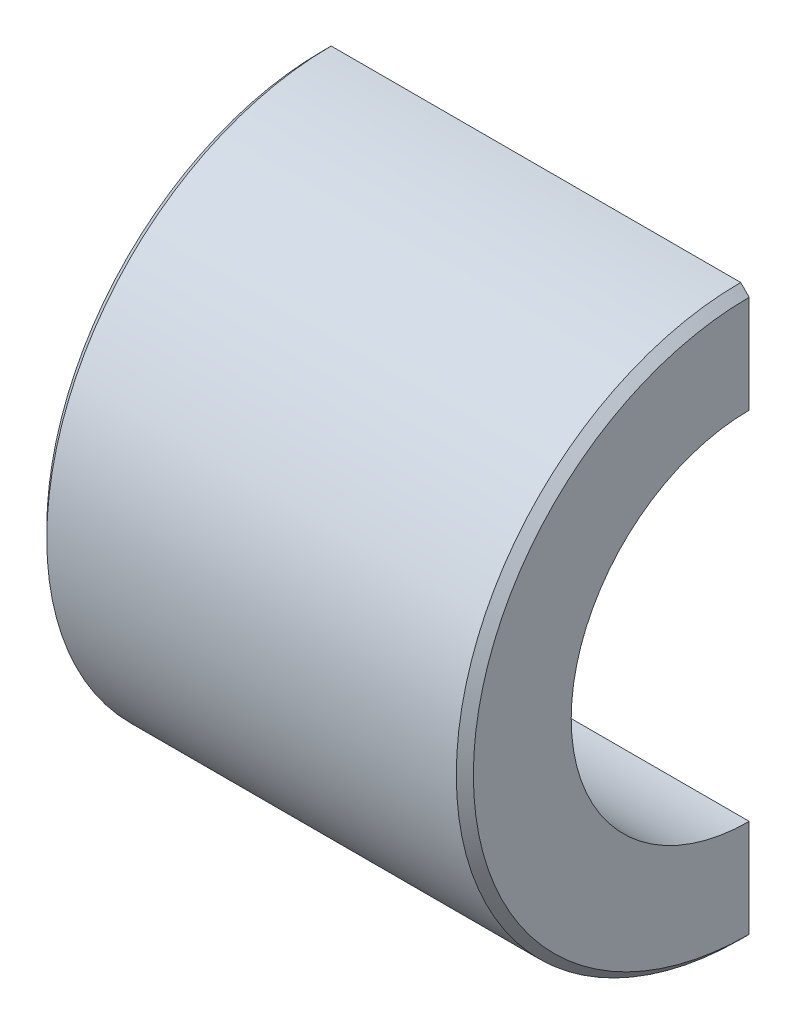
from build123d import *

# Parameters (mm, degrees)
PRIMARY_SKETCH_W      = 19.05
PRIMARY_SKETCH_H      = 4.7498
PRIMARY_REVOLVE_ANGLE = 180
EDGE_CHAMFER_SIZE     = 0.381


with BuildPart() as part:
    # Primary Sketch → Primary Revolve (revolve)
    with BuildSketch(Plane.XY):
        with Locations((9.525, 10.3251)):
            Rectangle(PRIMARY_SKETCH_W, PRIMARY_SKETCH_H)
    revolve(axis=Axis((0, 0, 0), (1, 0, 0)), revolution_arc=PRIMARY_REVOLVE_ANGLE)

    # Edge Chamfer
    edge_chamfer_edges = [part.edges().sort_by_distance(p)[0] for p in [
        (19.05, 0, 12.7),
        (0, 0, 12.7),
    ]]
    chamfer(edge_chamfer_edges, length=EDGE_CHAMFER_SIZE)


solid = part.part
